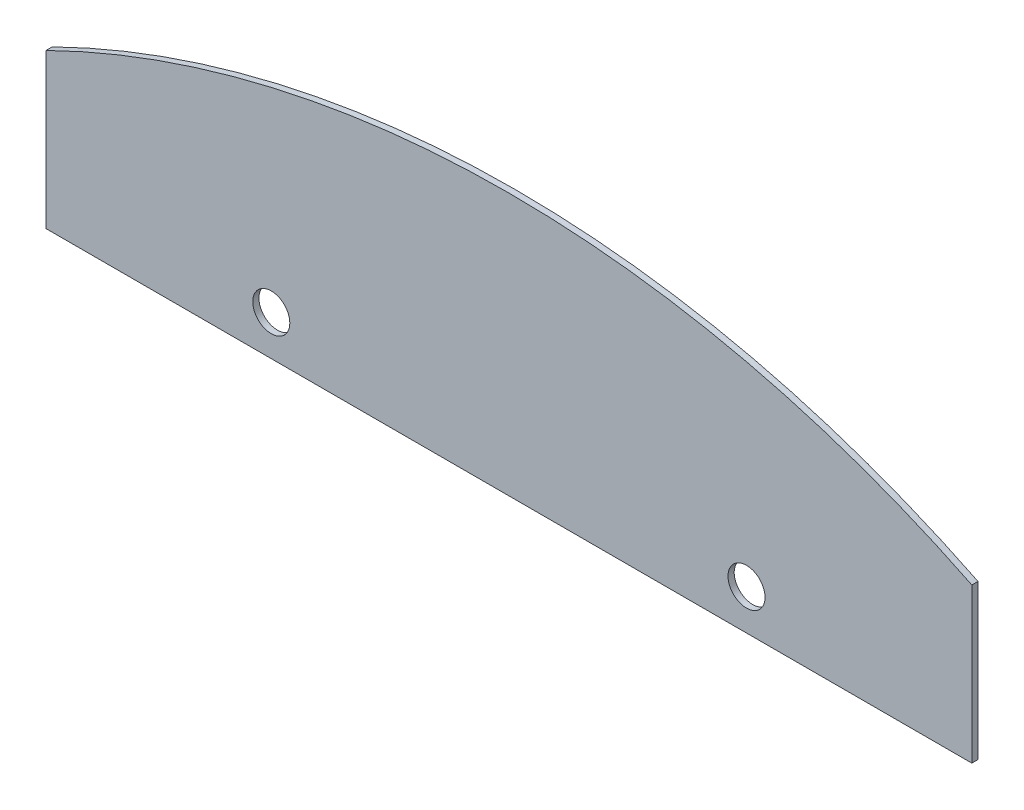
from build123d import *

# Parameters (mm, degrees)
SALIENTE_EXTRUIR1_DEPTH = 2
CROQUIS2_R              = 6
CORTAR_EXTRUIR1_DEPTH   = 173.420996401


with BuildPart() as part:
    # Croquis1 → Saliente-Extruir1 (new body)
    with BuildSketch(Plane.XY):
        with BuildLine():
            Line((-150, 0), (150, 0))
            Line((150, 0), (150, 50))
            ThreePointArc((150, 50), (0, 85), (-150, 50))
            Line((-150, 50), (-150, 0))
        make_face()
    extrude(amount=SALIENTE_EXTRUIR1_DEPTH)

    # Croquis2 → Cortar-Extruir1 (cut, through all)
    with BuildSketch(Plane.XY.offset(2)):
        with Locations((-77, 13)):
            Circle(CROQUIS2_R)
        with Locations((77, 13)):
            Circle(CROQUIS2_R)
    extrude(amount=-CORTAR_EXTRUIR1_DEPTH, mode=Mode.SUBTRACT)


solid = part.part
